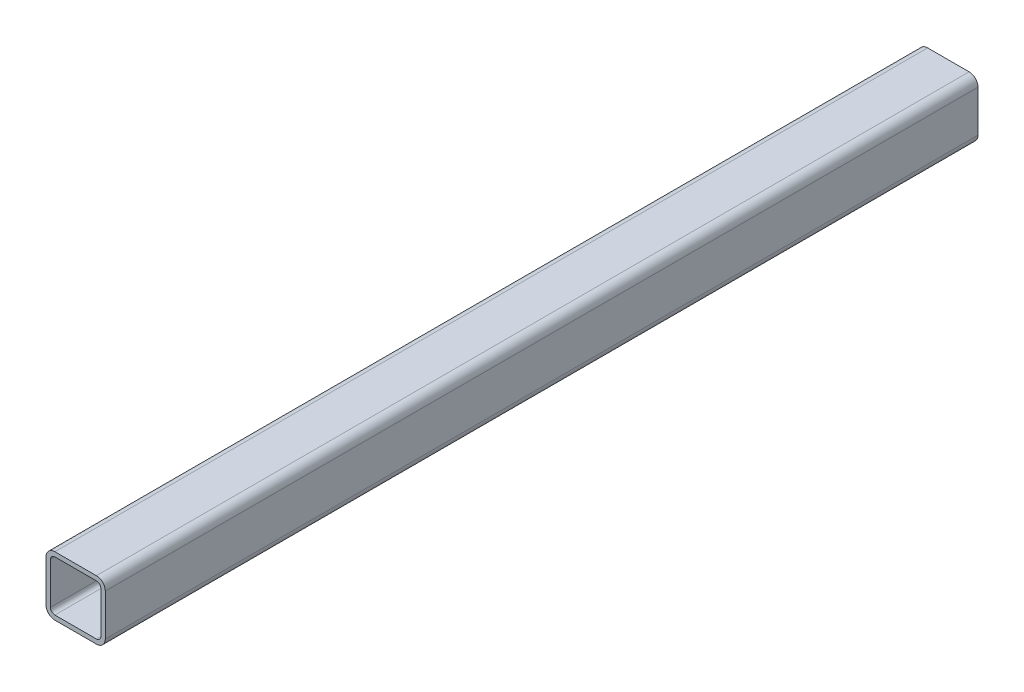
from build123d import *

# Parameters (mm, degrees)
EXTRUDE_1_DEPTH = 294.5


with BuildPart() as part:
    # Эскиз1 → Бобышка-Вытянуть1 (new, symmetric)
    with BuildSketch(Plane.XY):
        with BuildLine():
            Line((-14, 20), (14, 20))
            ThreePointArc((14, 20), (18.242640687, 18.242640687), (20, 14))
            Line((20, 14), (20, -14))
            ThreePointArc((20, -14), (18.242640687, -18.242640687), (14, -20))
            Line((14, -20), (-14, -20))
            ThreePointArc((-14, -20), (-18.242640687, -18.242640687), (-20, -14))
            Line((-20, -14), (-20, 14))
            ThreePointArc((-20, 14), (-18.242640687, 18.242640687), (-14, 20))
        make_face()
        with BuildLine():
            Line((-14, 17), (14, 17))
            ThreePointArc((14, 17), (16.121320344, 16.121320344), (17, 14))
            Line((17, 14), (17, -14))
            ThreePointArc((17, -14), (16.121320344, -16.121320344), (14, -17))
            Line((14, -17), (-14, -17))
            ThreePointArc((-14, -17), (-16.121320344, -16.121320344), (-17, -14))
            Line((-17, -14), (-17, 14))
            ThreePointArc((-17, 14), (-16.121320344, 16.121320344), (-14, 17))
        make_face(mode=Mode.SUBTRACT)
    extrude(amount=EXTRUDE_1_DEPTH, both=True)


solid = part.part
